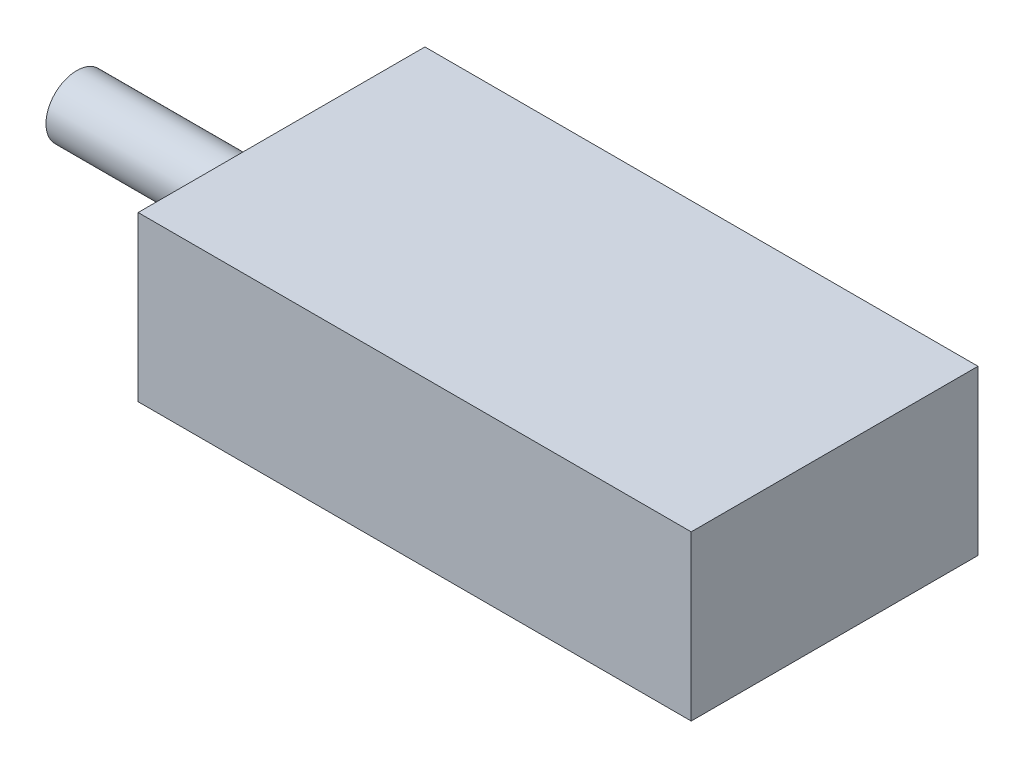
from build123d import *

# Parameters (mm, degrees)
SKETCH1_W       = 27
SKETCH1_H       = 14
HOUSING_DEPTH   = 8
WIRE_STUB_START = -23.5
SKETCH2_R       = 1.5
WIRE_STUB_DEPTH = 10


with BuildPart() as part:
    # Sketch1 → Housing (new body)
    with BuildSketch(Plane(origin=(0, 0, 0), x_dir=(1, 0, 0), z_dir=(0, 1, 0))):
        Rectangle(SKETCH1_W, SKETCH1_H)
    extrude(amount=HOUSING_DEPTH)

    # Sketch2 → Wire_Stub (add)
    with BuildSketch(Plane(origin=(0, 0, 0), x_dir=(0, 0, -1), z_dir=(1, 0, 0)).offset(WIRE_STUB_START)):
        with Locations((0, 4)):
            Circle(SKETCH2_R)
    extrude(amount=WIRE_STUB_DEPTH)


solid = part.part
